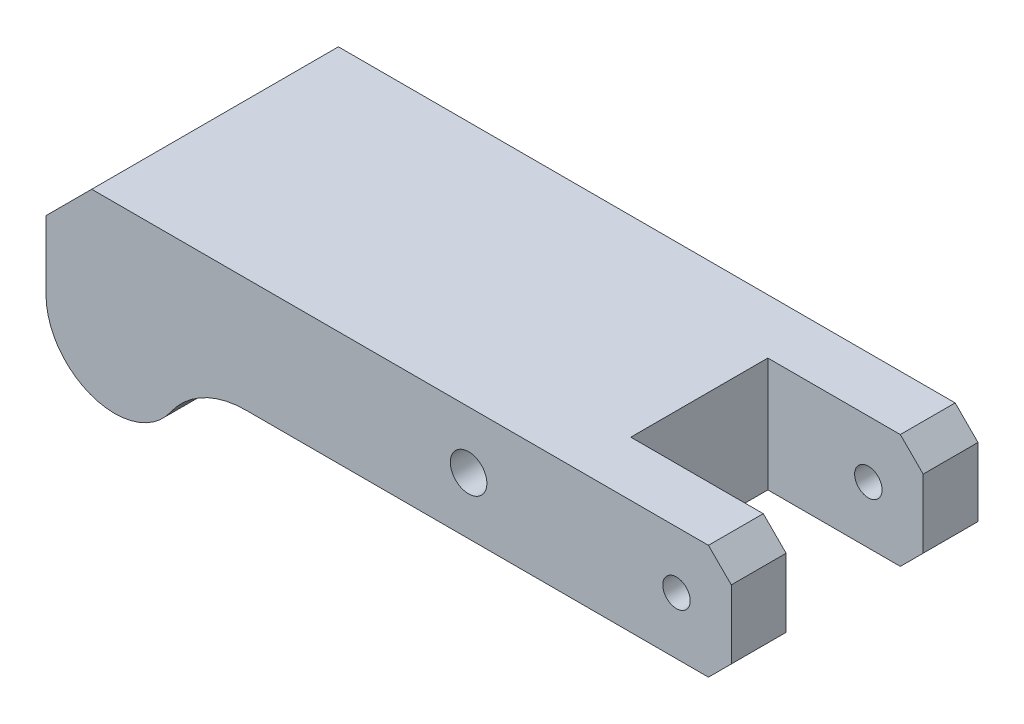
from build123d import *

# Parameters (mm, degrees)
SKETCH1_R           = 3
SKETCH1_R_2         = 4
BOSS_EXTRUDE1_DEPTH = 27
CHAMFER1_SIZE       = 10
CHAMFER2_SIZE       = 5
SKETCH2_W           = 48.313497882
SKETCH2_H           = 30
CUT_EXTRUDE1_DEPTH  = 158.572205671


with BuildPart() as part:
    # Sketch1 → Boss-Extrude1 (new, symmetric)
    with BuildSketch(Plane.XY):
        with BuildLine():
            Line((0, 0), (-106.277186767, 0))
            ThreePointArc((-106.277186767, 0), (-115.535387765, -2.271894791), (-122.6902229, -8.571428571))
            ThreePointArc((-122.6902229, -8.571428571), (-139.491845028, -14.311650088), (-150, 0))
            Line((-150, 0), (-150, 25))
            Line((-150, 25), (0, 25))
            Line((0, 25), (0, 0))
        make_face()
        with Locations((-12, 12.5)):
            Circle(SKETCH1_R, mode=Mode.SUBTRACT)
        with Locations((-57.5, 12.5)):
            Circle(SKETCH1_R_2, mode=Mode.SUBTRACT)
    extrude(amount=BOSS_EXTRUDE1_DEPTH, both=True)

    # Chamfer1
    chamfer1_edges = [part.edges().sort_by_distance(p)[0] for p in [
        (-150, 25, 0),
    ]]
    chamfer(chamfer1_edges, length=CHAMFER1_SIZE)

    # Chamfer2
    chamfer2_edges = [part.edges().sort_by_distance(p)[0] for p in [
        (0, 0, 0),
        (0, 25, 0),
    ]]
    chamfer(chamfer2_edges, length=CHAMFER2_SIZE)

    # Sketch2 → Cut-Extrude1 (cut, through all)
    with BuildSketch(Plane(origin=(0, 25, 0), x_dir=(1, 0, 0), z_dir=(0, 1, 0))):
        with Locations((-9.843251059, 0)):
            Rectangle(SKETCH2_W, SKETCH2_H)
    extrude(amount=-CUT_EXTRUDE1_DEPTH, mode=Mode.SUBTRACT)


solid = part.part
